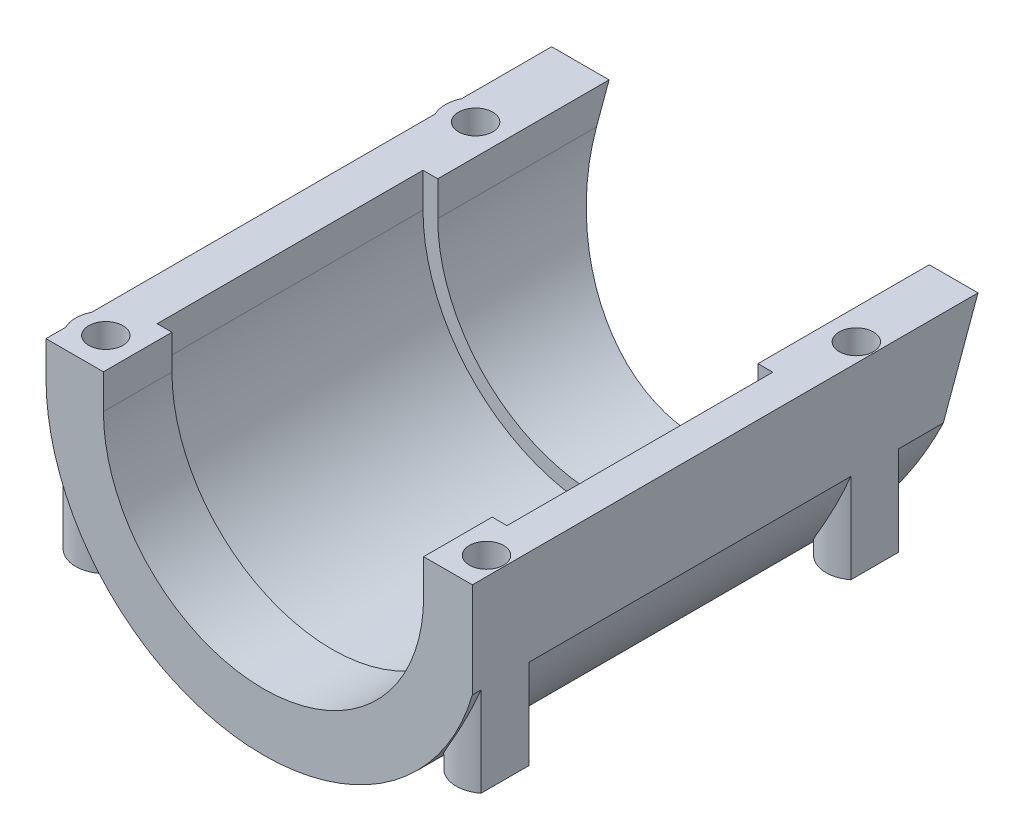
from build123d import *

# Parameters (mm, degrees)
REVOLVE1_ANGLE          = 180
BOSS_EXTRUDE1_DEPTH     = 5.02894
SKETCH4_R               = 2.5
CUT_EXTRUDE1_DEPTH      = 66.81878856
SKETCH5_R               = 4.41325
SKETCH5_R_2             = 2.5
BOSS_EXTRUDE2_DEPTH     = 26.9875
CUT_EXTRUDE2_DEPTH      = 64.37119497
CUT_EXTRUDE2_DEPTH_BACK = 64.37119497
CUT_EXTRUDE7_DEPTH      = 67.034356751
CUT_EXTRUDE7_DEPTH_BACK = 67.034356751
SKETCH8_W               = 7.909159593
SKETCH8_H               = 73.8


with BuildPart() as part:
    # Sketch1 → Revolve1 (revolve)
    with BuildSketch(Plane(origin=(0, 0, 0), x_dir=(1, 0, 0), z_dir=(0, 1, 0))):
        Polygon((23.368, 44.4), (31.75, 44.4), (31.75, -29.4), (23.368, -29.4), (23.368, -19.4), (25.527, -19.4), (25.527, 19.4), (23.368, 19.4), align=None)
    revolve(axis=Axis((0, 0, 55), (0, 0, -1)), revolution_arc=REVOLVE1_ANGLE)

    # Sketch3 → Boss-Extrude1 (add)
    with BuildSketch(Plane(origin=(0, 0, 0), x_dir=(1, 0, 0), z_dir=(0, 1, 0))):
        Polygon((23.368, 44.4), (23.368, 19.4), (25.527, 19.4), (25.527, -19.4), (23.368, -19.4), (23.368, -29.4), (31.75, -29.4), (31.75, 44.4), align=None)
        Polygon((-23.368, 19.4), (-23.368, 44.4), (-31.75, 44.4), (-31.75, -29.4), (-23.368, -29.4), (-23.368, -19.4), (-25.527, -19.4), (-25.527, 19.4), align=None)
    extrude(amount=BOSS_EXTRUDE1_DEPTH)

    # Sketch4 → Cut-Extrude1 (cut, through all)
    with BuildSketch(Plane(origin=(0, 5.02894, 0), x_dir=(1, 0, 0), z_dir=(0, 1, 0))):
        with Locations(Location((-27.78125, 29.3375, 0), (0, 0, 180))):
            Circle(SKETCH4_R)
        with Locations(Location((27.78125, 29.3375, 0), (0, 0, 180))):
            Circle(SKETCH4_R)
        with Locations(Location((27.78125, -24.6375, 0), (0, 0, 180))):
            Circle(SKETCH4_R)
        with Locations(Location((-27.78125, -24.6375, 0), (0, 0, 180))):
            Circle(SKETCH4_R)
    extrude(amount=-CUT_EXTRUDE1_DEPTH, mode=Mode.SUBTRACT)

    # Sketch5 → Boss-Extrude2 (add)
    # profile 1 of 4: a face of its own
    with BuildSketch(Plane(origin=(0, 5.02894, 0), x_dir=(1, 0, 0), z_dir=(0, 1, 0))):
        with Locations(Location((-27.78125, 29.3375, 0), (0, 0, 180))):
            Circle(SKETCH5_R)
        with Locations(Location((-27.78125, 29.3375, 0), (0, 0, 180))):
            Circle(SKETCH5_R_2, mode=Mode.SUBTRACT)
    # profile 2 of 4: a face of its own
    with BuildSketch(Plane(origin=(0, 5.02894, 0), x_dir=(1, 0, 0), z_dir=(0, 1, 0))):
        with Locations(Location((-27.78125, -24.6375, 0), (0, 0, 180))):
            Circle(SKETCH5_R)
        with Locations(Location((-27.78125, -24.6375, 0), (0, 0, 180))):
            Circle(SKETCH5_R_2, mode=Mode.SUBTRACT)
    # profile 3 of 4: a face of its own
    with BuildSketch(Plane(origin=(0, 5.02894, 0), x_dir=(1, 0, 0), z_dir=(0, 1, 0))):
        with Locations(Location((27.78125, -24.6375, 0), (0, 0, 180))):
            Circle(SKETCH5_R)
        with Locations(Location((27.78125, -24.6375, 0), (0, 0, 180))):
            Circle(SKETCH5_R_2, mode=Mode.SUBTRACT)
    # profile 4 of 4: a face of its own
    with BuildSketch(Plane(origin=(0, 5.02894, 0), x_dir=(1, 0, 0), z_dir=(0, 1, 0))):
        with Locations(Location((27.78125, 29.3375, 0), (0, 0, 180))):
            Circle(SKETCH5_R)
        with Locations(Location((27.78125, 29.3375, 0), (0, 0, 180))):
            Circle(SKETCH5_R_2, mode=Mode.SUBTRACT)
    extrude(amount=-BOSS_EXTRUDE2_DEPTH)

    # Sketch6 → Cut-Extrude2 (cut, two sides: drawn at the far end of the back side and taken through both)
    with BuildSketch(Plane(origin=(0, 0, 0), x_dir=(0, 0, -1), z_dir=(1, 0, 0)).offset(-CUT_EXTRUDE2_DEPTH_BACK)):
        Polygon((44.4, 5.02894), (31.013560592, -31.75), (44.4, -31.75), align=None)
    extrude(amount=CUT_EXTRUDE2_DEPTH + CUT_EXTRUDE2_DEPTH_BACK, mode=Mode.SUBTRACT)

    # Sketch8 → Cut-Extrude7 (cut, two sides: drawn at the far end of the back side and taken through both)
    with BuildSketch(Plane(origin=(0, 5.02894, 0), x_dir=(1, 0, 0), z_dir=(0, 1, 0)).offset(-CUT_EXTRUDE7_DEPTH_BACK)):
        with Locations((34.434579797, 7.5)):
            Rectangle(SKETCH8_W, SKETCH8_H)
    extrude(amount=CUT_EXTRUDE7_DEPTH + CUT_EXTRUDE7_DEPTH_BACK, mode=Mode.SUBTRACT)


solid = part.part
